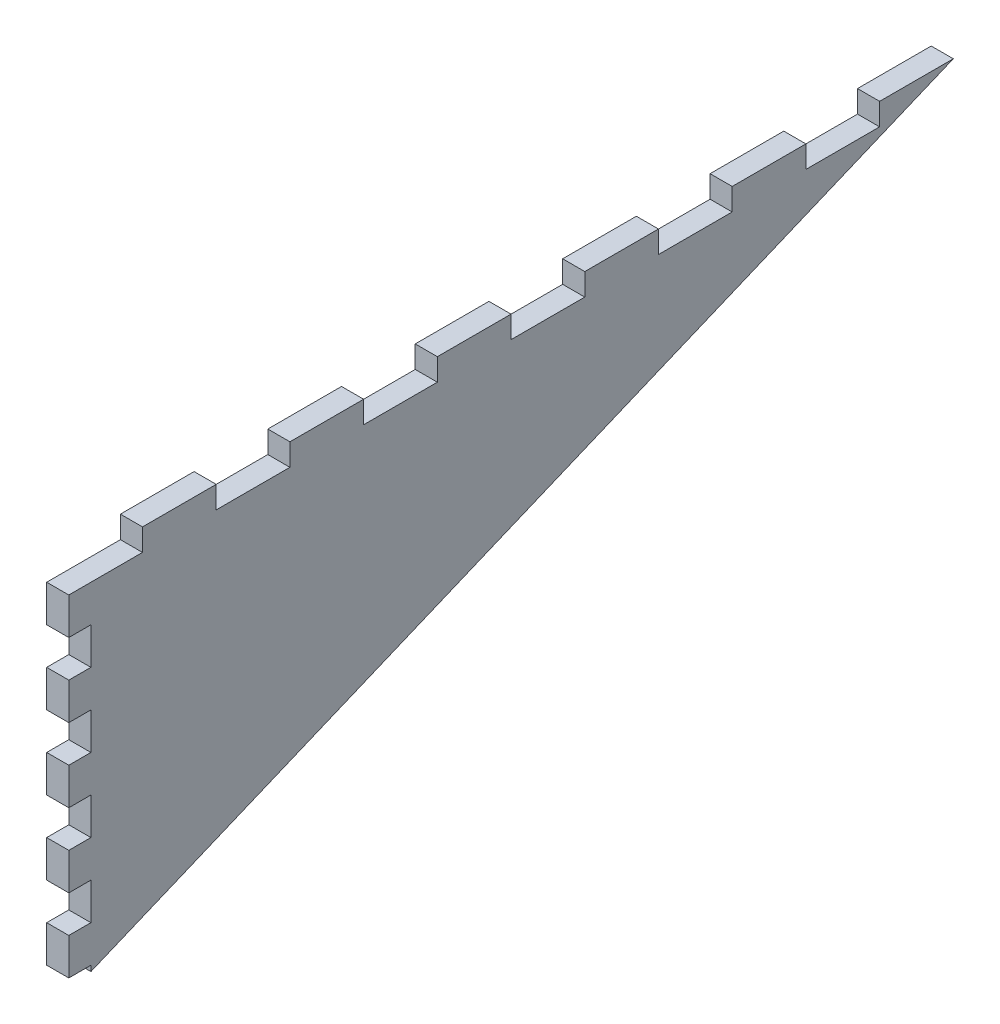
from build123d import *

# Parameters (mm, degrees)
BOSS_EXTRUDE1_DEPTH = 3


with BuildPart() as part:
    # Sketch1 → Boss-Extrude1 (new body)
    with BuildSketch(Plane(origin=(0, 0, 0), x_dir=(0, 0, -1), z_dir=(1, 0, 0))):
        Polygon((10, -3), (0, -3), (0, -8), (3, -8), (3, -13), (0, -13), (0, -18), (3, -18), (3, -23), (0, -23), (0, -28), (3, -28), (3, -33), (0, -33), (0, -38), (3, -38), (3, -43), (0, -43), (0, -48), (3, -48), (3, -48.75), (120, 0), (110, 0), (110, -3), (100, -3), (100, 0), (90, 0), (90, -3), (80, -3), (80, 0), (70, 0), (70, -3), (60, -3), (60, 0), (50, 0), (50, -3), (40, -3), (40, 0), (30, 0), (30, -3), (20, -3), (20, 0), (10, 0), align=None)
    extrude(amount=BOSS_EXTRUDE1_DEPTH)


solid = part.part
